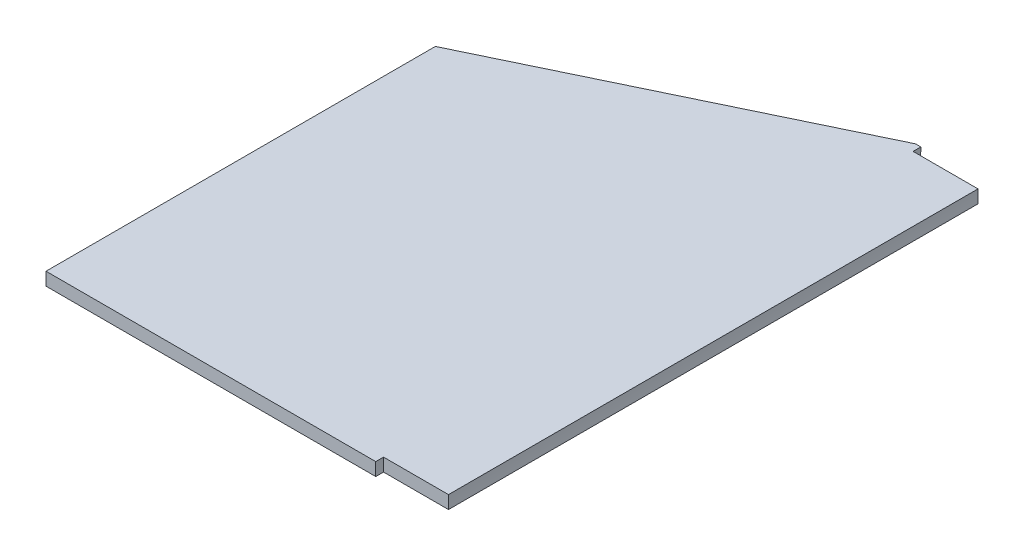
from build123d import *

# Parameters (mm, degrees)
BOSS_EXTRUDE1_DEPTH      = 2.5
BOSS_EXTRUDE1_DEPTH_BACK = 2.5
SKETCH2_R                = 51.2
CUT_EXTRUDE1_DEPTH       = 245.399774959
SKETCH3_R                = 76.2
CUT_EXTRUDE2_DEPTH       = 3
CUT_EXTRUDE3_START       = -3
SKETCH4_R                = 76.2
CUT_EXTRUDE3_DEPTH       = 3


with BuildPart() as part:
    # Sketch1 → Boss-Extrude1 (new, two sides: drawn at the far end of the back side and taken through both)
    with BuildSketch(Plane(origin=(0, 0, 0), x_dir=(1, 0, 0), z_dir=(0, 1, 0)).offset(-BOSS_EXTRUDE1_DEPTH_BACK)):
        Polygon((-125, 150), (-125, 0), (0, 0), (78.2, 0), (78.2, 210), (0, 210), align=None)
    extrude(amount=BOSS_EXTRUDE1_DEPTH + BOSS_EXTRUDE1_DEPTH_BACK)

    # Sketch2 → Cut-Extrude1 (cut, through all)
    with BuildSketch(Plane(origin=(0, 0, -210), x_dir=(-1, 0, 0), z_dir=(0, 0, -1))):
        with Locations((-78.2, 0)):
            Circle(SKETCH2_R)
    extrude(amount=-CUT_EXTRUDE1_DEPTH, mode=Mode.SUBTRACT)

    # Sketch3 → Cut-Extrude2 (cut)
    with BuildSketch(Plane(origin=(0, 0, -210), x_dir=(-1, 0, 0), z_dir=(0, 0, -1))):
        with Locations((-78.2, 0)):
            Circle(SKETCH3_R)
    extrude(amount=-CUT_EXTRUDE2_DEPTH, mode=Mode.SUBTRACT)

    # Sketch4 → Cut-Extrude3 (cut)
    with BuildSketch(Plane.XY.offset(CUT_EXTRUDE3_START)):
        with Locations((78.2, 0)):
            Circle(SKETCH4_R)
    extrude(amount=CUT_EXTRUDE3_DEPTH, mode=Mode.SUBTRACT)


solid = part.part
